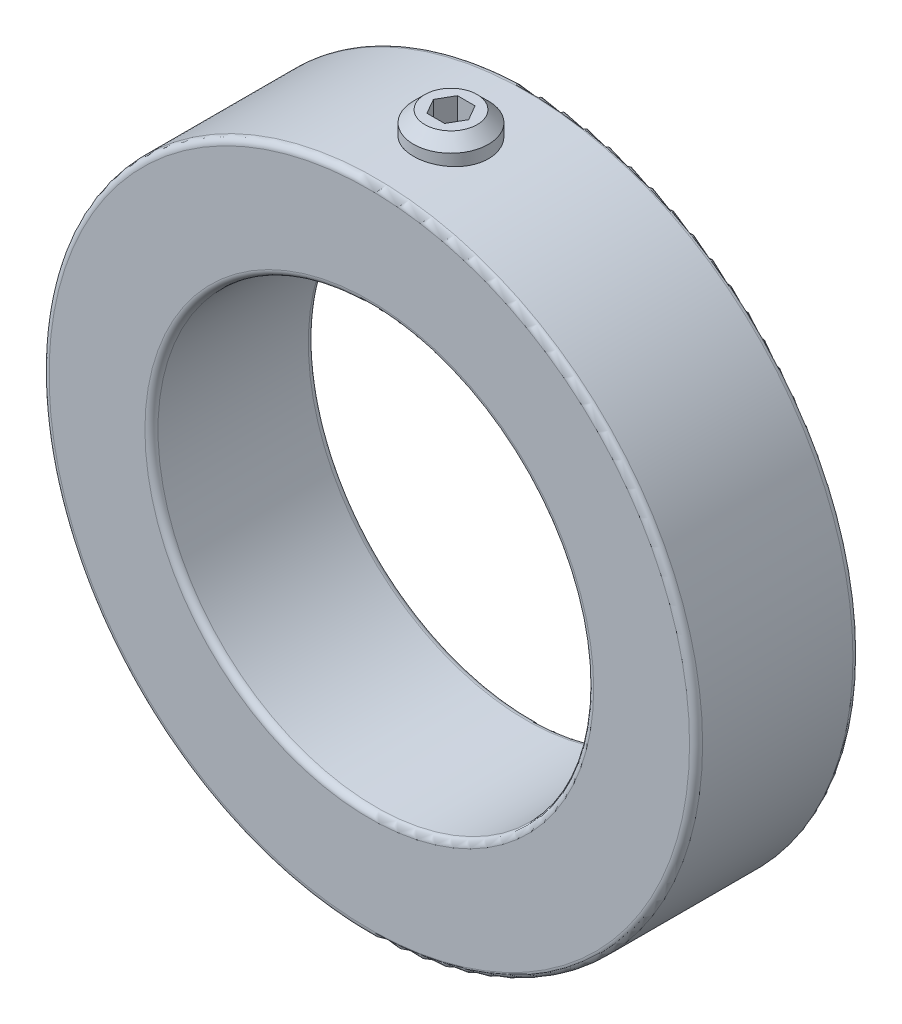
from build123d import *

# Parameters (mm, degrees)
SKETCH1_R          = 9.525
SKETCH1_R_2        = 6.35
EXTRUDE1_DEPTH     = 2.38125
SKETCH2_R          = 1.0922
CUT_EXTRUDE1_DEPTH = 52.740080949
FILLET1_R          = 0.1905
CUT_EXTRUDE2_DEPTH = 0.889


with BuildPart() as part:
    # Sketch1 → Extrude1 (new, symmetric)
    with BuildSketch(Plane.XY):
        with Locations(Location((0, 0, 0), (0, 0, 180))):
            Circle(SKETCH1_R)
        with Locations(Location((0, 0, 0), (0, 0, 180))):
            Circle(SKETCH1_R_2, mode=Mode.SUBTRACT)
    extrude(amount=EXTRUDE1_DEPTH, both=True)

    # Sketch2 → Cut-Extrude1 (cut, through all)
    with BuildSketch(Plane(origin=(41.275, 0, 0), x_dir=(0, 0, -1), z_dir=(0, -1, 0))):
        with Locations((0, -41.275)):
            Circle(SKETCH2_R)
    extrude(amount=-CUT_EXTRUDE1_DEPTH, mode=Mode.SUBTRACT)

    # Fillet1
    fillet1_edges = [part.edges().sort_by_distance(p)[0] for p in [
        (9.525, 0, -2.38125),
        (9.525, 0, 2.38125),
        (6.35, 0, -2.38125),
        (6.35, 0, 2.38125),
    ]]
    fillet(fillet1_edges, radius=FILLET1_R)


with BuildPart() as body_2:
    # Sketch3 → Revolve1 (revolve)
    with BuildSketch(Plane.XY):
        Polygon((-0.761379651, 6.35), (-0.396984419, 6.35), (0, 6.746984419), (0, 10.16), (-0.761379651, 10.16), (-1.0922, 9.829179651), (-1.0922, 6.680820349), align=None)
    revolve(axis=Axis((0, 6.35, 0), (0, -1, 0)))

    # Sketch4 → Cut-Extrude2 (cut)
    with BuildSketch(Plane(origin=(3.3734375, 10.16, 0), x_dir=(0, 0, -1), z_dir=(0, -1, 0))):
        Polygon((0, -2.860173111), (-0.4445, -3.116805305), (-0.4445, -3.630069695), (0, -3.886701889), (0.4445, -3.630069695), (0.4445, -3.116805305), align=None)
    extrude(amount=CUT_EXTRUDE2_DEPTH, mode=Mode.SUBTRACT)


solid = Compound([part.part, body_2.part])
